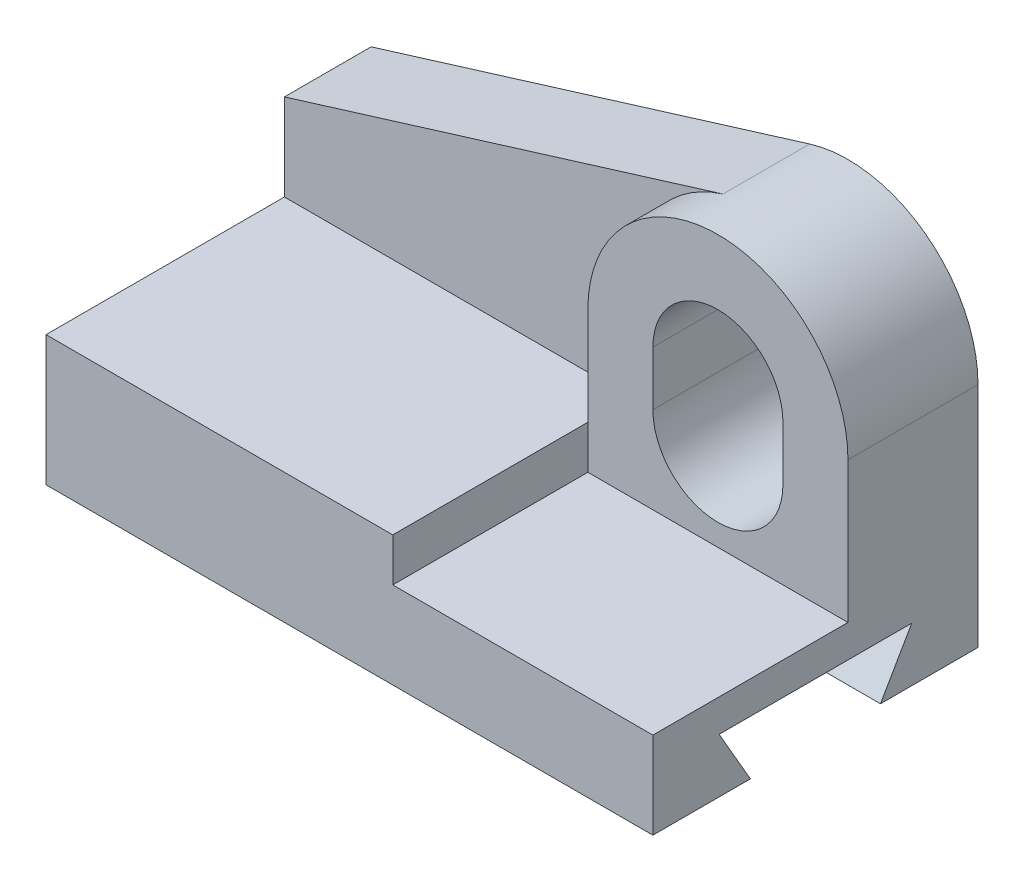
from build123d import *

# Parameters (mm, degrees)
SKETCH_1_W          = 56
SKETCH_1_H          = 30
EXTRUDE_1_DEPTH     = 12
CUT_EXTRUDE_1_DEPTH = 60.203040462
SKETCH_3_W          = 24
SKETCH_3_H          = 22
CUT_EXTRUDE_3_DEPTH = 4
SKETCH_4_W          = 56
SKETCH_4_H          = 8
EXTRUDE_2_DEPTH     = 25
CUT_EXTRUDE_5_DEPTH = 25
CUT_EXTRUDE_6_DEPTH = 49.548944376
EXTRUDE_START       = 4
EXTRUDE_3_DEPTH     = 4


with BuildPart() as part:
    # 草图1 → 凸台-拉伸1 (new body)
    with BuildSketch(Plane(origin=(0, 0, 0), x_dir=(1, 0, 0), z_dir=(0, 1, 0))):
        Rectangle(SKETCH_1_W, SKETCH_1_H)
    extrude(amount=EXTRUDE_1_DEPTH)

    # 草图2 → 切除-拉伸1 (cut, through all)
    with BuildSketch(Plane.ZY.offset(28)):
        Polygon((-6, 0), (6, 0), (8.886751346, 5), (-8.886751346, 5), align=None)
    extrude(amount=-CUT_EXTRUDE_1_DEPTH, mode=Mode.SUBTRACT)

    # 草图3 → 切除-拉伸3 (cut)
    with BuildSketch(Plane(origin=(0, 12, 0), x_dir=(1, 0, 0), z_dir=(0, 1, 0))):
        with Locations((16, -4)):
            Rectangle(SKETCH_3_W, SKETCH_3_H)
    extrude(amount=-CUT_EXTRUDE_3_DEPTH, mode=Mode.SUBTRACT)

    # 草图4 → 凸台-拉伸2 (add)
    with BuildSketch(Plane(origin=(0, 12, 0), x_dir=(1, 0, 0), z_dir=(0, 1, 0))):
        with Locations((0, 11)):
            Rectangle(SKETCH_4_W, SKETCH_4_H)
    extrude(amount=EXTRUDE_2_DEPTH)

    # 草图5 → 切除-拉伸5 (cut)
    with BuildSketch(Plane.XY.offset(-7)):
        with BuildLine():
            Line((16, 37), (16, 33))
            ThreePointArc((16, 33), (24.485281374, 29.485281374), (28, 21))
            Line((28, 21), (28, 37))
            Line((28, 37), (16, 37))
        make_face()
        with BuildLine():
            ThreePointArc((12.466636051, 32.468013743), (14.213406162, 32.866258149), (16, 33))
            Line((16, 33), (16, 37))
            Line((16, 37), (-28, 37))
            Line((-28, 37), (-28, 20))
            Line((-28, 20), (12.466636051, 32.468013743))
        make_face()
    extrude(amount=-CUT_EXTRUDE_5_DEPTH, mode=Mode.SUBTRACT)

    # 草图6 → 切除-拉伸6 (cut, through all)
    with BuildSketch(Plane.XY.offset(-7)):
        with BuildLine():
            Line((10, 21), (10, 16))
            ThreePointArc((10, 16), (16, 10), (22, 16))
            Line((22, 16), (22, 21))
            ThreePointArc((22, 21), (16, 27), (10, 21))
        make_face()
    extrude(amount=-CUT_EXTRUDE_6_DEPTH, mode=Mode.SUBTRACT)

    # 草图7 → 凸台-拉伸3 (add)
    with BuildSketch(Plane.XY.offset(-7).offset(EXTRUDE_START)):
        with BuildLine():
            Line((4, 12), (4, 8))
            Line((4, 8), (28, 8))
            Line((28, 8), (28, 21))
            ThreePointArc((28, 21), (23.127398986, 30.654024223), (12.466636051, 32.468013743))
            ThreePointArc((12.466636051, 32.468013743), (6.345975777, 28.127398986), (4, 21))
            Line((4, 21), (4, 12))
        make_face()
        with BuildLine():
            Line((22, 21), (22, 16))
            ThreePointArc((22, 16), (16, 10), (10, 16))
            Line((10, 16), (10, 21))
            ThreePointArc((10, 21), (16, 27), (22, 21))
        make_face(mode=Mode.SUBTRACT)
    extrude(amount=-EXTRUDE_3_DEPTH)


solid = part.part
